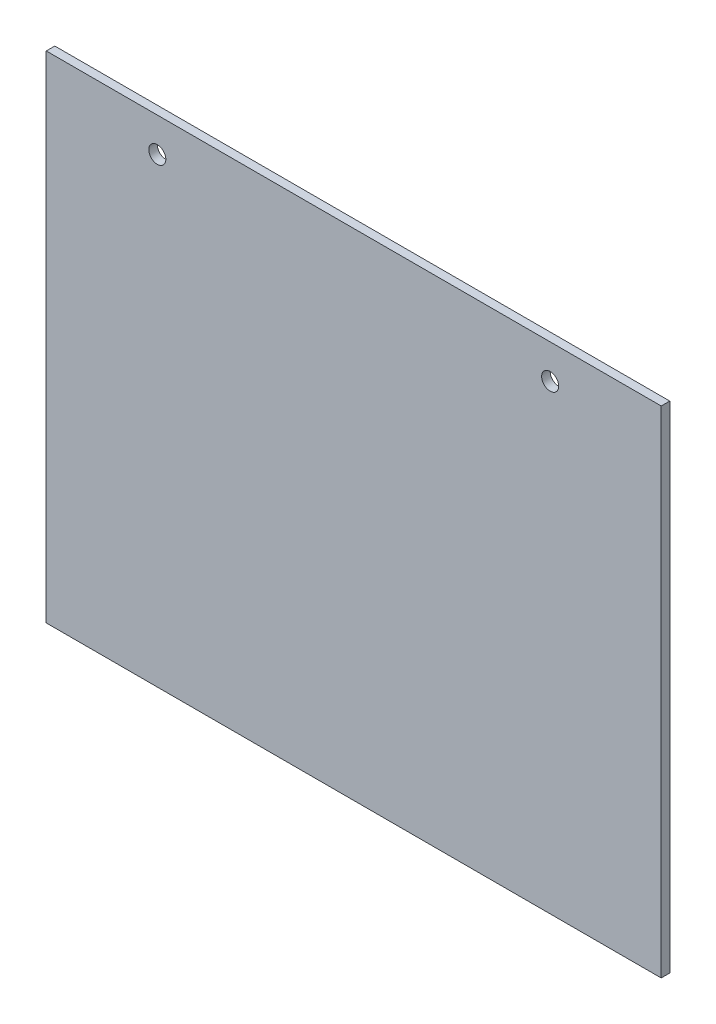
from build123d import *

# Parameters (mm, degrees)
ESBO_O1_W                = 360
ESBO_O1_H                = 290
RESSALTO_EXTRUS_O1_DEPTH = 5
ESBO_O2_R                = 5
CORTE_EXTRUS_O1_DEPTH    = 463.304012529


with BuildPart() as part:
    # Esboço1 → Ressalto-extrusão1 (new body)
    with BuildSketch(Plane.XY):
        with Locations((180, 145)):
            Rectangle(ESBO_O1_W, ESBO_O1_H)
    extrude(amount=RESSALTO_EXTRUS_O1_DEPTH)

    # Esboço2 → Corte-extrusão1 (cut, through all)
    with BuildSketch(Plane.XY.offset(5)):
        with Locations((65, 270)):
            Circle(ESBO_O2_R)
        with Locations((295, 270)):
            Circle(ESBO_O2_R)
    extrude(amount=-CORTE_EXTRUS_O1_DEPTH, mode=Mode.SUBTRACT)


solid = part.part
